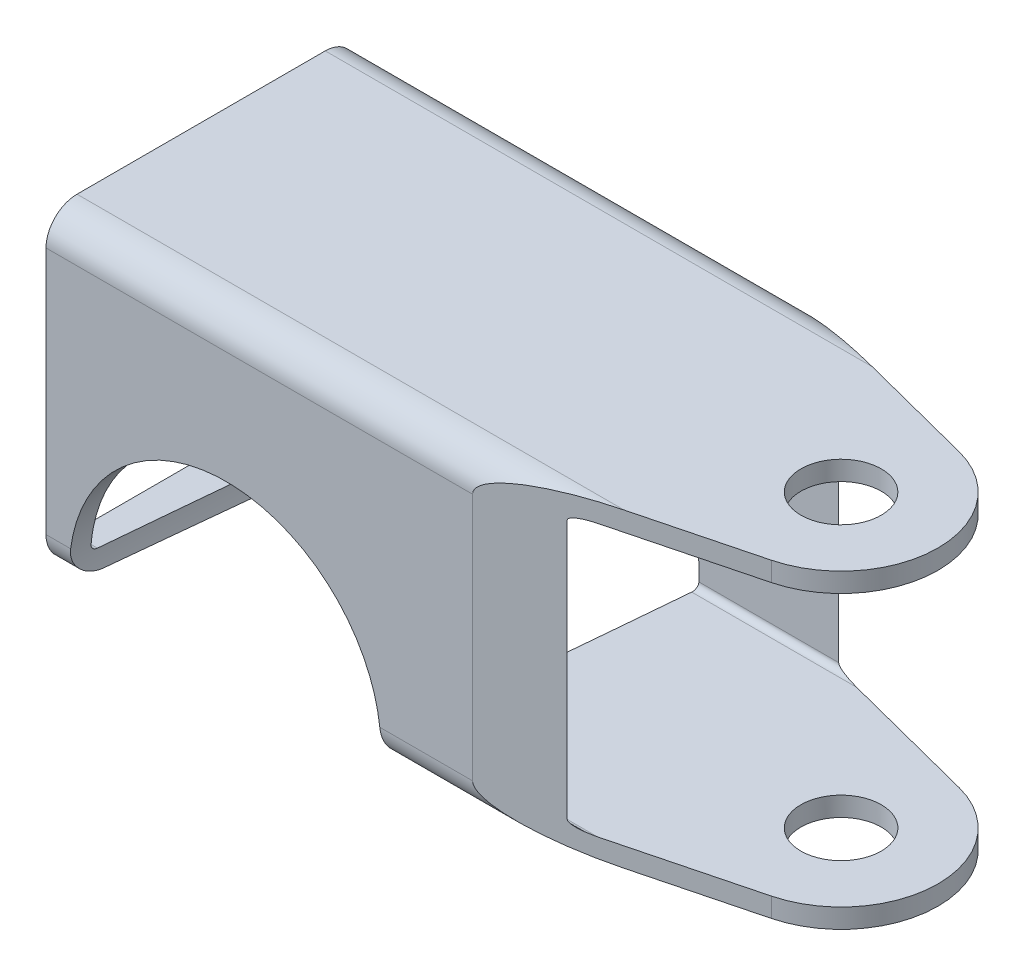
from build123d import *

# Parameters (mm, degrees)
BOSS_EXTRUDE1_DEPTH      = 25.4
BOSS_EXTRUDE1_DEPTH_BACK = 34.925
CUT_EXTRUDE4_DEPTH       = 63.941922635
CUT_EXTRUDE5_DEPTH       = 46.01339384
SKETCH14_R               = 3.2893
CUT_EXTRUDE6_DEPTH       = 46.01339384
CUT_EXTRUDE7_DEPTH       = 12.7
CUT_EXTRUDE7_DEPTH_BACK  = 38.1
SKETCH15_R               = 12.7


with BuildPart() as part:
    # Sketch1 → Boss-Extrude1 (new, two sides: drawn at the far end of the back side and taken through both)
    with BuildSketch(Plane(origin=(0, 0, 0), x_dir=(0, 0, -1), z_dir=(1, 0, 0)).offset(-BOSS_EXTRUDE1_DEPTH_BACK)):
        with BuildLine():
            Line((-10.16, 12.7), (10.16, 12.7))
            ThreePointArc((10.16, 12.7), (11.956051224, 11.956051224), (12.7, 10.16))
            Line((12.7, 10.16), (12.7, -10.16))
            ThreePointArc((12.7, -10.16), (11.956051224, -11.956051224), (10.16, -12.7))
            Line((10.16, -12.7), (-10.16, -12.7))
            ThreePointArc((-10.16, -12.7), (-11.956051224, -11.956051224), (-12.7, -10.16))
            Line((-12.7, -10.16), (-12.7, 10.16))
            ThreePointArc((-12.7, 10.16), (-11.956051224, 11.956051224), (-10.16, 12.7))
        make_face()
    extrude(amount=BOSS_EXTRUDE1_DEPTH + BOSS_EXTRUDE1_DEPTH_BACK)

    # Sketch11 → Cut-Extrude4 (cut, through all)
    with BuildSketch(Plane(origin=(25.4, 0, 0), x_dir=(0, 0, -1), z_dir=(1, 0, 0))):
        with BuildLine():
            Line((-10.6045, 11.1125), (10.6045, 11.1125))
            ThreePointArc((10.6045, 11.1125), (10.963710245, 10.963710245), (11.1125, 10.6045))
            Line((11.1125, 10.6045), (11.1125, -10.6045))
            ThreePointArc((11.1125, -10.6045), (10.963710245, -10.963710245), (10.6045, -11.1125))
            Line((10.6045, -11.1125), (-10.6045, -11.1125))
            ThreePointArc((-10.6045, -11.1125), (-10.963710245, -10.963710245), (-11.1125, -10.6045))
            Line((-11.1125, -10.6045), (-11.1125, 10.6045))
            ThreePointArc((-11.1125, 10.6045), (-10.963710245, 10.963710245), (-10.6045, 11.1125))
        make_face()
    extrude(amount=-CUT_EXTRUDE4_DEPTH, mode=Mode.SUBTRACT)

    # Sketch12 → Cut-Extrude5 (cut, through all)
    with BuildSketch(Plane(origin=(0, 12.7, 0), x_dir=(1, 0, 0), z_dir=(0, 1, 0))):
        with BuildLine():
            Line((50.8, 12.7), (0, 12.7))
            Line((0, 12.7), (19.444424463, 7.686083637))
            ThreePointArc((19.444424463, 7.686083637), (25.4, 0), (19.444424463, -7.686083637))
            Line((19.444424463, -7.686083637), (0, -12.7))
            Line((0, -12.7), (50.8, -12.7))
            Line((50.8, -12.7), (50.8, 12.7))
        make_face()
    extrude(amount=-CUT_EXTRUDE5_DEPTH, mode=Mode.SUBTRACT)

    # Sketch14 → Cut-Extrude6 (cut, through all)
    with BuildSketch(Plane(origin=(0, 12.7, 0), x_dir=(1, 0, 0), z_dir=(0, 1, 0))):
        with Locations((17.4625, 0)):
            Circle(SKETCH14_R)
    extrude(amount=-CUT_EXTRUDE6_DEPTH, mode=Mode.SUBTRACT)

    # Sketch15 → Cut-Extrude7 (cut, two sides: drawn at the far end of the back side and taken through both)
    with BuildSketch(Plane(origin=(-20.264891118, -11.75578997, 12.7), x_dir=(0.9956294808615994, -0.006900458495911921, 0.09313603229582162), z_dir=(-0.09339131029845407, -0.07356465915336388, 0.9929080038374086)).offset(-CUT_EXTRUDE7_DEPTH_BACK)):
        Circle(SKETCH15_R)
    extrude(amount=CUT_EXTRUDE7_DEPTH + CUT_EXTRUDE7_DEPTH_BACK, mode=Mode.SUBTRACT)


solid = part.part
